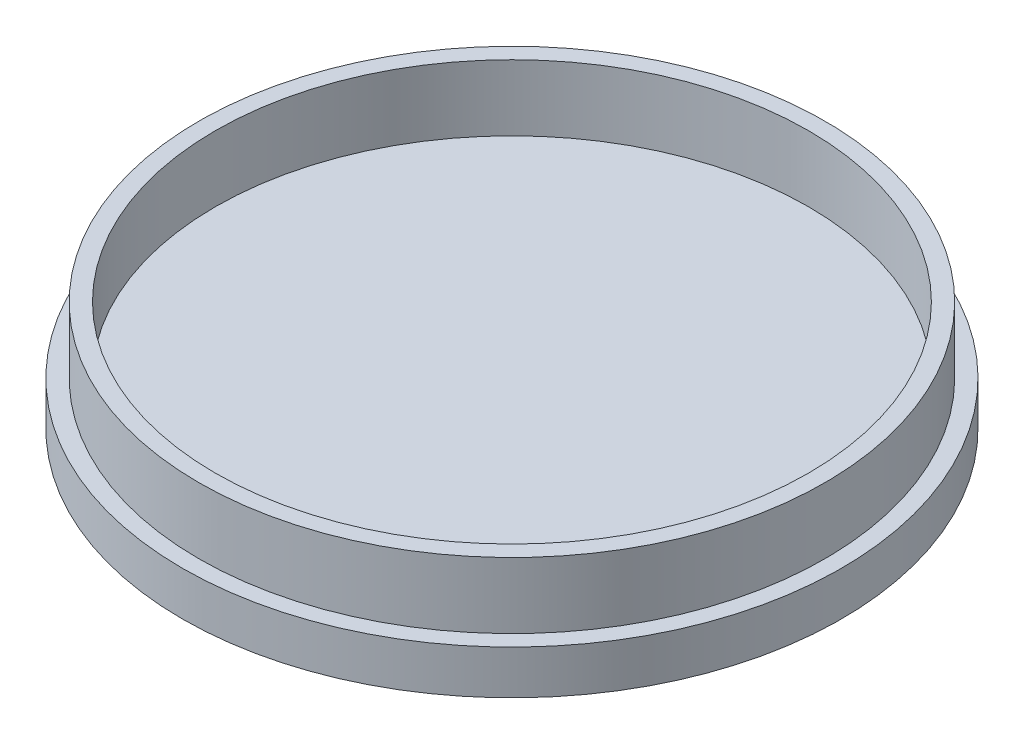
from build123d import *

# Parameters (mm, degrees)
SKETCH1_R           = 15
BOSS_EXTRUDE3_DEPTH = 2
SKETCH2_R           = 14.25
SKETCH2_R_2         = 13.5
BOSS_EXTRUDE4_DEPTH = 3
SKETCH6_R           = 0.5


with BuildPart() as part:
    # Sketch1 → Boss-Extrude3 (new body)
    with BuildSketch(Plane(origin=(0, 0, 0), x_dir=(1, 0, 0), z_dir=(0, 1, 0))):
        with Locations(Location((0, 0, 0), (0, 0, 270))):
            Circle(SKETCH1_R)
    extrude(amount=BOSS_EXTRUDE3_DEPTH)

    # Sketch2 → Boss-Extrude4 (add)
    with BuildSketch(Plane(origin=(0, 2, 0), x_dir=(1, 0, 0), z_dir=(0, 1, 0))):
        with Locations(Location((0, 0, 0), (0, 0, 270))):
            Circle(SKETCH2_R)
        with Locations(Location((0, 0, 0), (0, 0, 270))):
            Circle(SKETCH2_R_2, mode=Mode.SUBTRACT)
    extrude(amount=BOSS_EXTRUDE4_DEPTH)

    # Sweep1: sweep along a path in Sketch7
    with BuildLine(Plane(origin=(0, 0, 0), x_dir=(0, 0, -1), z_dir=(1, 0, 0))) as sweep1_path:
        Line((-3.5, 0), (-3.5, -1))
        ThreePointArc((-3.5, -1), (-3.207106781, -1.707106781), (-2.5, -2))
        Line((-2.5, -2), (2.5, -2))
        ThreePointArc((2.5, -2), (3.207106781, -1.707106781), (3.5, -1))
        Line((3.5, -1), (3.5, 0))
    # Sketch6 → Sweep1 (sweep)
    with BuildSketch(Plane.XZ):
        with Locations((0, 3.5)):
            Circle(SKETCH6_R)
    sweep(path=sweep1_path.line)


solid = part.part
